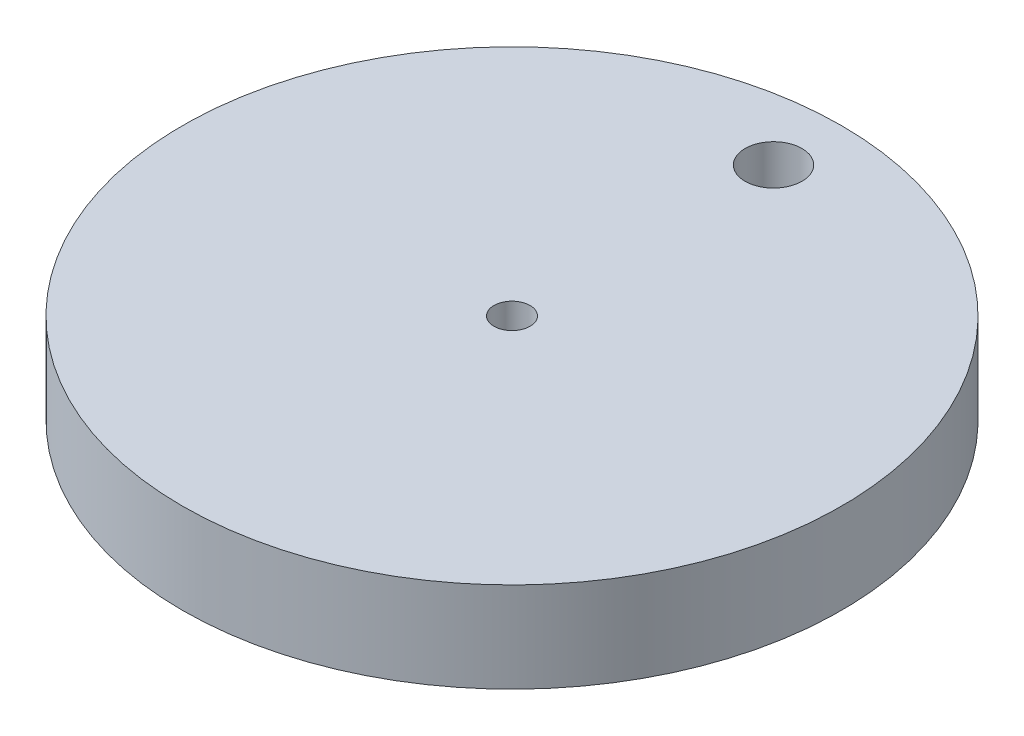
from build123d import *

# Parameters (mm, degrees)
SKETCH1_R           = 46.355
SKETCH1_R_2         = 2.54
SKETCH1_R_3         = 4
BOSS_EXTRUDE1_DEPTH = 12.7


with BuildPart() as part:
    # Sketch1 → Boss-Extrude1 (new body)
    with BuildSketch(Plane(origin=(0, 0, 0), x_dir=(1, 0, 0), z_dir=(0, 1, 0))):
        with Locations(Location((0, 0, 0), (0, 0, 270))):
            Circle(SKETCH1_R)
        with Locations(Location((0, 0, 0), (0, 0, 270))):
            Circle(SKETCH1_R_2, mode=Mode.SUBTRACT)
        with Locations(Location((0, 36.785016562, 0), (0, 0, 270))):
            Circle(SKETCH1_R_3, mode=Mode.SUBTRACT)
    extrude(amount=BOSS_EXTRUDE1_DEPTH)


solid = part.part
